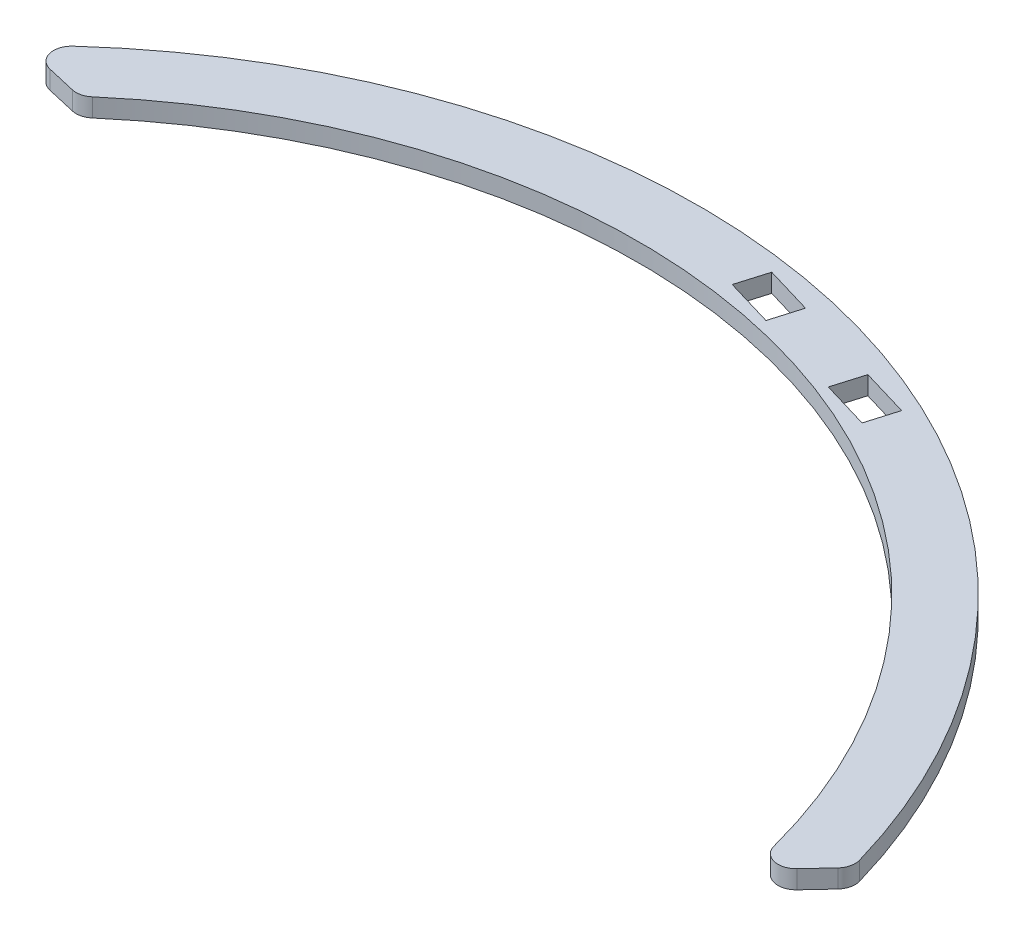
from build123d import *

# Parameters (mm, degrees)
EXTRUDE_1_DEPTH     = 3
CUT_EXTRUDE_3_DEPTH = 5
FILLET_5_R          = 3


with BuildPart() as part:
    # Эскиз2 → Бобышка-Вытянуть1 (new body)
    with BuildSketch(Plane(origin=(0, 0, 0), x_dir=(1, 0, 0), z_dir=(0, 1, 0))):
        with BuildLine():
            Line((97.975465344, 20.020194571), (106.165355323, 28.790924422))
            ThreePointArc((106.165355323, 28.790924422), (28.149005714, 106.337356923), (-78.01634961, 77.546432501))
            Line((-78.01634961, 77.546432501), (-66.325729759, 74.83914465))
            ThreePointArc((-66.325729759, 74.83914465), (31.649735585, 94.859339221), (97.975465344, 20.020194571))
        make_face()
    extrude(amount=EXTRUDE_1_DEPTH)

    # Эскиз3 → Вырез-Вытянуть3 (cut)
    with BuildSketch(Plane(origin=(0, 3, 0), x_dir=(1, 0, 0), z_dir=(0, 1, 0))):
        Polygon((36.108993933, 94.920117092), (43.969168032, 92.583952898), (45.450638009, 97.568453546), (37.59046391, 99.90461774), align=None)
        Polygon((13.736254487, 101.569638102), (21.596428586, 99.233473909), (23.077898562, 104.217974556), (15.217724464, 106.55413875), align=None)
    extrude(amount=-CUT_EXTRUDE_3_DEPTH, mode=Mode.SUBTRACT)

    # Скругление5
    fillet_5_edges = [part.edges().sort_by_distance(p)[0] for p in [
        (-66.325729759, 1.5, -74.83914465),
        (-78.01634961, 1.5, -77.546432501),
        (106.165355323, 1.5, -28.790924422),
        (97.975465344, 1.5, -20.020194571),
    ]]
    fillet(fillet_5_edges, radius=FILLET_5_R)


solid = part.part
